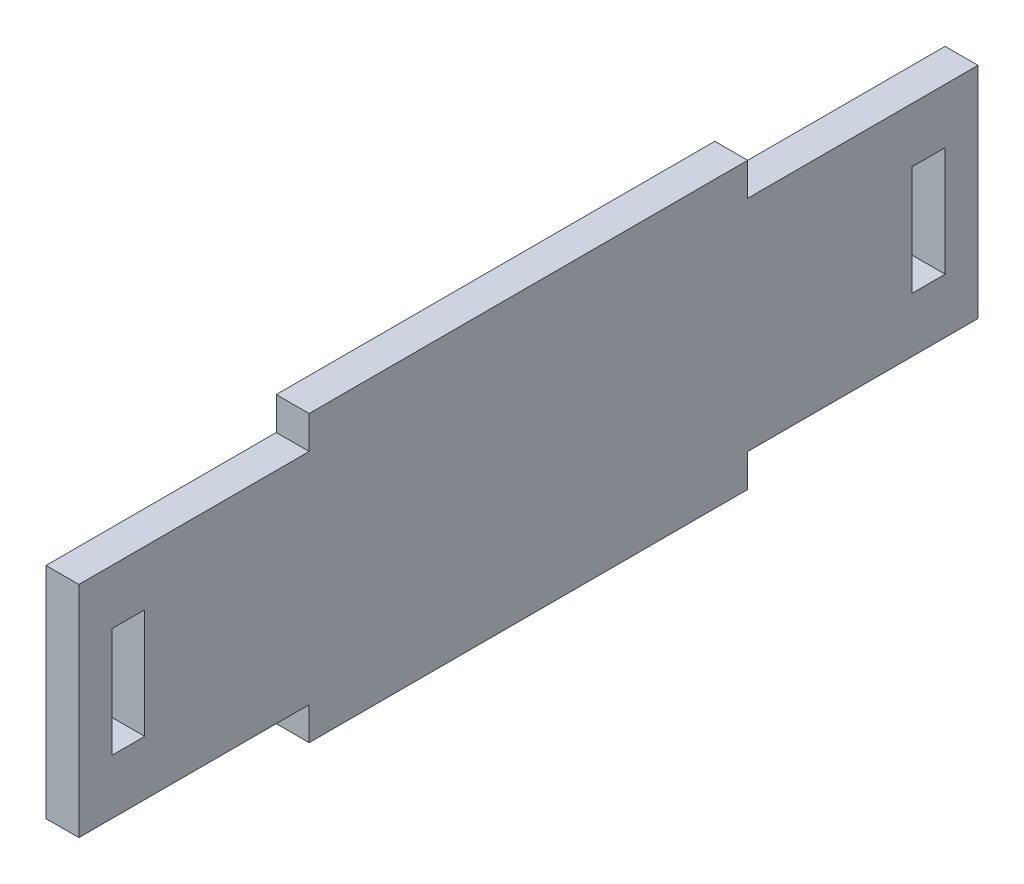
from build123d import *

# Parameters (mm, degrees)
SKETCH1_W           = 3
SKETCH1_H           = 10
BOSS_EXTRUDE1_DEPTH = 3


with BuildPart() as part:
    # Sketch1 → Boss-Extrude1 (new body)
    with BuildSketch(Plane(origin=(0, 0, 0), x_dir=(0, 0, -1), z_dir=(1, 0, 0))):
        Polygon((-6, 0), (-6, 20), (15, 20), (15, 23), (55, 23), (55, 20), (76, 20), (76, 0), (55, 0), (55, -3), (15, -3), (15, 0), align=None)
        with Locations((-1.5, 10)):
            Rectangle(SKETCH1_W, SKETCH1_H, mode=Mode.SUBTRACT)
        with Locations((71.5, 10)):
            Rectangle(SKETCH1_W, SKETCH1_H, mode=Mode.SUBTRACT)
    extrude(amount=BOSS_EXTRUDE1_DEPTH)


solid = part.part
